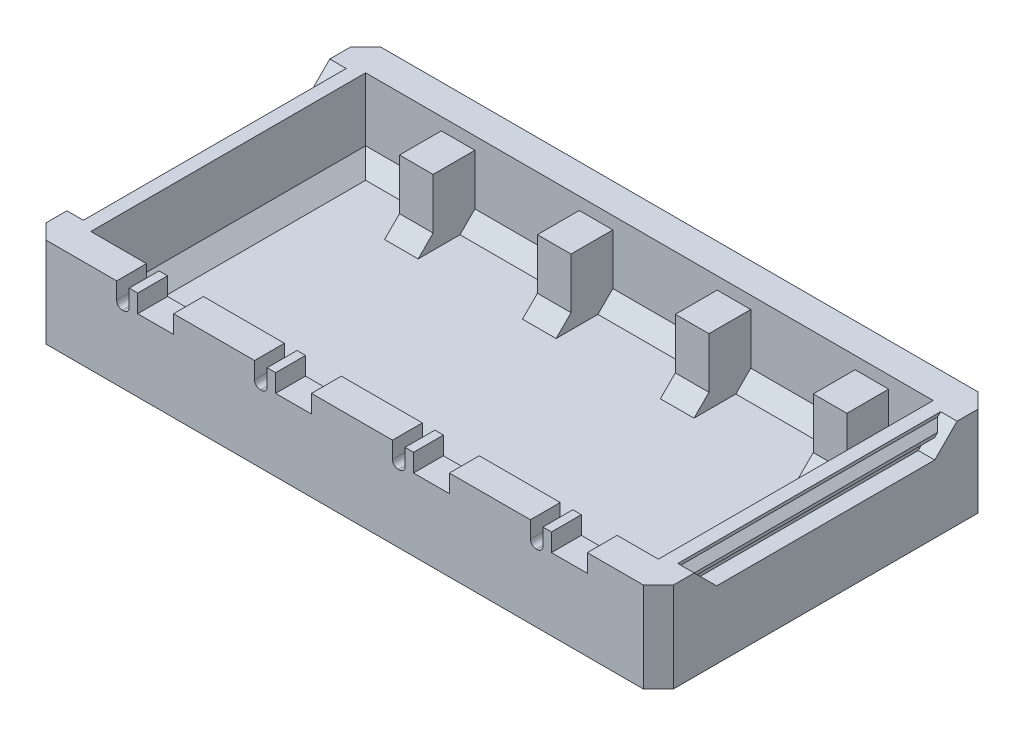
from build123d import *

# Parameters (mm, degrees)
SKETCH2_W           = 210
SKETCH2_H           = 112
SKETCH2_W_2         = 190
SKETCH2_H_2         = 92
BOSS_EXTRUDE1_DEPTH = 30.16
SKETCH3_W           = 210
SKETCH3_H           = 112
BOSS_EXTRUDE2_DEPTH = 4
SKETCH4_W           = 11.25
SKETCH4_H           = 13.999999996
BOSS_EXTRUDE3_DEPTH = 22
SKETCH5_W           = 12
SKETCH5_H           = 10
CUT_EXTRUDE1_DEPTH  = 6
CHAMFER2_SIZE       = 5
CUT_EXTRUDE2_DEPTH  = 5.5
CUT_EXTRUDE3_DEPTH  = 5.5
SKETCH9_W           = 4.2
SKETCH9_H           = 10
CUT_EXTRUDE4_DEPTH  = 7.5
FILLET1_R           = 1.88
CHAMFER3_SIZE       = 5
CHAMFER4_SIZE       = 5
BOSS_EXTRUDE4_START = -10
BOSS_EXTRUDE4_DEPTH = 90


with BuildPart() as part:
    # Sketch2 → Boss-Extrude1 (new body)
    with BuildSketch(Plane(origin=(0, 0, 0), x_dir=(1, 0, 0), z_dir=(0, 1, 0))):
        with Locations((-15.529354961, -23.471700962)):
            Rectangle(SKETCH2_W, SKETCH2_H)
        with Locations((-15.529354961, -23.471700962)):
            Rectangle(SKETCH2_W_2, SKETCH2_H_2, mode=Mode.SUBTRACT)
    extrude(amount=BOSS_EXTRUDE1_DEPTH)



with BuildPart() as body_2:
    # Sketch3 → Boss-Extrude2 (new body)
    with BuildSketch(Plane.XZ):
        with Locations((-15.529354961, 23.471700962)):
            Rectangle(SKETCH3_W, SKETCH3_H)
    extrude(amount=-BOSS_EXTRUDE2_DEPTH)


with BuildPart() as part_1:
    add(part.part)

    add(body_2.part)  # Boss-Extrude3 merges body 2
    # Sketch4 → Boss-Extrude3 (add)
    with BuildSketch(Plane(origin=(0, 4, 0), x_dir=(1, 0, 0), z_dir=(0, 1, 0))):
        with Locations((-79.564354961, 15.52829904)):
            Rectangle(SKETCH4_W, SKETCH4_H)
        with Locations((-33.394354961, 15.52829904)):
            Rectangle(SKETCH4_W, SKETCH4_H)
        with Locations((12.775645039, 15.52829904)):
            Rectangle(SKETCH4_W, SKETCH4_H)
        with Locations((58.945645039, 15.52829904)):
            Rectangle(SKETCH4_W, SKETCH4_H)
    extrude(amount=BOSS_EXTRUDE3_DEPTH)

    # Sketch5 → Cut-Extrude1 (cut)
    with BuildSketch(Plane(origin=(0, 30.16, 0), x_dir=(1, 0, 0), z_dir=(0, 1, 0))):
        with Locations((-78.829354961, -74.471700962)):
            Rectangle(SKETCH5_W, SKETCH5_H)
        with Locations((-32.659354961, -74.471700962)):
            Rectangle(SKETCH5_W, SKETCH5_H)
        with Locations((13.510645039, -74.471700962)):
            Rectangle(SKETCH5_W, SKETCH5_H)
        with Locations((59.680645039, -74.471700962)):
            Rectangle(SKETCH5_W, SKETCH5_H)
    extrude(amount=-CUT_EXTRUDE1_DEPTH, mode=Mode.SUBTRACT)

    # Chamfer2
    chamfer2_edges = [part_1.edges().sort_by_distance(p)[0] for p in [
        (-110.529354961, 4, 23.471700962),
        (-97.859354961, 4, -22.528299038),
        (-56.479354961, 4, -22.528299038),
        (79.470645039, 4, 23.471700962),
        (-15.529354961, 4, 69.471700962),
        (-10.309354961, 4, -22.528299038),
        (35.860645039, 4, -22.528299038),
        (72.020645039, 4, -22.528299038),
    ]]
    chamfer(chamfer2_edges, length=CHAMFER2_SIZE)

    # Sketch6 → Cut-Extrude2 (cut)
    with BuildSketch(Plane.ZY.offset(120.529354961)):
        Polygon((-20.528299038, 30.16), (67.471700962, 30.16), (59.971700962, 22.66), (-13.028299038, 22.66), align=None)
    extrude(amount=-CUT_EXTRUDE2_DEPTH, mode=Mode.SUBTRACT)

    # Sketch8 → Cut-Extrude3 (cut)
    with BuildSketch(Plane(origin=(89.470645039, 0, 0), x_dir=(0, 0, -1), z_dir=(1, 0, 0))):
        Polygon((20.528299038, 30.16), (13.028299038, 22.66), (-59.971700962, 22.66), (-67.471700962, 30.16), align=None)
    extrude(amount=-CUT_EXTRUDE3_DEPTH, mode=Mode.SUBTRACT)

    # Sketch9 → Cut-Extrude4 (cut)
    with BuildSketch(Plane(origin=(0, 30.16, 0), x_dir=(1, 0, 0), z_dir=(0, 1, 0))):
        with Locations((-89.789354961, -74.471700962)):
            Rectangle(SKETCH9_W, SKETCH9_H)
        with Locations((48.720645039, -74.471700962)):
            Rectangle(SKETCH9_W, SKETCH9_H)
        with Locations((2.550645039, -74.471700962)):
            Rectangle(SKETCH9_W, SKETCH9_H)
        with Locations((-43.619354961, -74.471700962)):
            Rectangle(SKETCH9_W, SKETCH9_H)
    extrude(amount=-CUT_EXTRUDE4_DEPTH, mode=Mode.SUBTRACT)

    # Fillet1
    fillet1_edges = [part_1.edges().sort_by_distance(p)[0] for p in [
        (-87.689354961, 22.66, 74.471700962),
        (-91.889354961, 22.66, 74.471700962),
        (50.820645039, 22.66, 74.471700962),
        (46.620645039, 22.66, 74.471700962),
        (4.650645039, 22.66, 74.471700962),
        (0.450645039, 22.66, 74.471700962),
        (-41.519354961, 22.66, 74.471700962),
        (-45.719354961, 22.66, 74.471700962),
    ]]
    fillet(fillet1_edges, radius=FILLET1_R)

    # Chamfer3
    chamfer3_edges = [part_1.edges().sort_by_distance(p)[0] for p in [
        (-79.564354961, 4, -8.528299042),
        (-33.394354961, 4, -8.528299042),
        (12.775645039, 4, -8.528299042),
        (58.945645039, 4, -8.528299042),
    ]]
    chamfer(chamfer3_edges, length=CHAMFER3_SIZE)

    # Chamfer4
    chamfer4_edges = [part_1.edges().sort_by_distance(p)[0] for p in [
        (89.470645039, 15.08, 79.471700962),
        (-120.529354961, 15.08, 79.471700962),
        (-120.529354961, 15.08, -32.528299038),
        (89.470645039, 15.08, -32.528299038),
    ]]
    chamfer(chamfer4_edges, length=CHAMFER4_SIZE)

    # Sketch10 → Boss-Extrude4 (add)
    with BuildSketch(Plane.XY.offset(79.471700962).offset(BOSS_EXTRUDE4_START)):
        Polygon((83.970645039, 29.16), (86.220645039, 26.91), (86.220645039, 25.91), (83.970645039, 23.66), align=None)
        Polygon((-115.029354961, 29.16), (-115.029354961, 23.66), (-117.279354961, 25.91), (-117.279354961, 26.91), align=None)
    extrude(amount=-BOSS_EXTRUDE4_DEPTH)


solid = part_1.part
